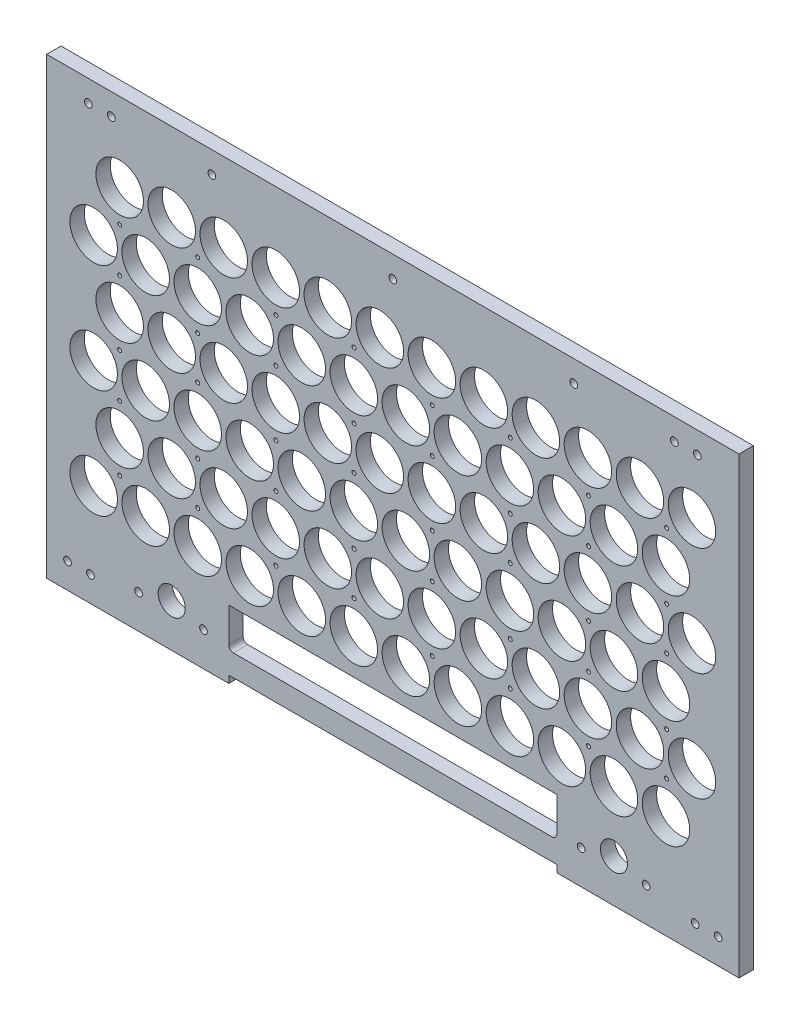
from build123d import *

# Parameters (mm, degrees)
SKETCH1_W                  = 306.05000007
SKETCH1_H                  = 197.4250001
BOSS_EXTRUDE1_DEPTH        = 6.35
SKETCH3_R                  = 10.4988
CUT_EXTRUDE1_DEPTH         = 187.132543615
SKETCH4_R                  = 10.4988
CUT_EXTRUDE2_DEPTH         = 187.132543615
LPATTERN1_COUNT            = 12
LPATTERN1_PITCH            = 23
LPATTERN2_COUNT            = 3
LPATTERN2_PITCH            = 48
LPATTERN2_COPY_1_SKETCH_R  = 10.4988
LPATTERN2_COPY_1_DEPTH     = 187.132543615
LPATTERN2_COPY_2_SKETCH_R  = 10.4988
LPATTERN2_COPY_2_DEPTH     = 187.132543615
LPATTERN2_COPY_3_SKETCH_R  = 10.4988
LPATTERN2_COPY_3_DEPTH     = 187.132543615
LPATTERN2_COPY_4_SKETCH_R  = 10.4988
LPATTERN2_COPY_4_DEPTH     = 187.132543615
LPATTERN2_COPY_5_SKETCH_R  = 10.4988
LPATTERN2_COPY_5_DEPTH     = 187.132543615
LPATTERN2_COPY_6_SKETCH_R  = 10.4988
LPATTERN2_COPY_6_DEPTH     = 187.132543615
LPATTERN2_COPY_7_SKETCH_R  = 10.4988
LPATTERN2_COPY_7_DEPTH     = 187.132543615
LPATTERN2_COPY_8_SKETCH_R  = 10.4988
LPATTERN2_COPY_8_DEPTH     = 187.132543615
LPATTERN2_COPY_9_SKETCH_R  = 10.4988
LPATTERN2_COPY_9_DEPTH     = 187.132543615
LPATTERN2_COPY_10_SKETCH_R = 10.4988
LPATTERN2_COPY_10_DEPTH    = 187.132543615
LPATTERN2_COPY_11_SKETCH_R = 10.4988
LPATTERN2_COPY_11_DEPTH    = 187.132543615
LPATTERN2_COPY_12_SKETCH_R = 10.4988
LPATTERN2_COPY_12_DEPTH    = 187.132543615
LPATTERN2_COPY_13_SKETCH_R = 10.4988
LPATTERN2_COPY_13_DEPTH    = 187.132543615
LPATTERN2_COPY_14_SKETCH_R = 10.4988
LPATTERN2_COPY_14_DEPTH    = 187.132543615
LPATTERN2_COPY_15_SKETCH_R = 10.4988
LPATTERN2_COPY_15_DEPTH    = 187.132543615
LPATTERN2_COPY_16_SKETCH_R = 10.4988
LPATTERN2_COPY_16_DEPTH    = 187.132543615
LPATTERN2_COPY_17_SKETCH_R = 10.4988
LPATTERN2_COPY_17_DEPTH    = 187.132543615
LPATTERN2_COPY_18_SKETCH_R = 10.4988
LPATTERN2_COPY_18_DEPTH    = 187.132543615
LPATTERN2_COPY_19_SKETCH_R = 10.4988
LPATTERN2_COPY_19_DEPTH    = 187.132543615
LPATTERN2_COPY_20_SKETCH_R = 10.4988
LPATTERN2_COPY_20_DEPTH    = 187.132543615
LPATTERN2_COPY_21_SKETCH_R = 10.4988
LPATTERN2_COPY_21_DEPTH    = 187.132543615
LPATTERN2_COPY_22_SKETCH_R = 10.4988
LPATTERN2_COPY_22_DEPTH    = 187.132543615
LPATTERN2_COPY_23_SKETCH_R = 10.4988
LPATTERN2_COPY_23_DEPTH    = 187.132543615
LPATTERN2_COPY_24_SKETCH_R = 10.4988
LPATTERN2_COPY_24_DEPTH    = 187.132543615
LPATTERN2_COPY_25_SKETCH_R = 10.4988
LPATTERN2_COPY_25_DEPTH    = 187.132543615
LPATTERN2_COPY_26_SKETCH_R = 10.4988
LPATTERN2_COPY_26_DEPTH    = 187.132543615
LPATTERN2_COPY_27_SKETCH_R = 10.4988
LPATTERN2_COPY_27_DEPTH    = 187.132543615
LPATTERN2_COPY_28_SKETCH_R = 10.4988
LPATTERN2_COPY_28_DEPTH    = 187.132543615
LPATTERN2_COPY_29_SKETCH_R = 10.4988
LPATTERN2_COPY_29_DEPTH    = 187.132543615
LPATTERN2_COPY_30_SKETCH_R = 10.4988
LPATTERN2_COPY_30_DEPTH    = 187.132543615
LPATTERN2_COPY_31_SKETCH_R = 10.4988
LPATTERN2_COPY_31_DEPTH    = 187.132543615
LPATTERN2_COPY_32_SKETCH_R = 10.4988
LPATTERN2_COPY_32_DEPTH    = 187.132543615
LPATTERN2_COPY_33_SKETCH_R = 10.4988
LPATTERN2_COPY_33_DEPTH    = 187.132543615
LPATTERN2_COPY_34_SKETCH_R = 10.4988
LPATTERN2_COPY_34_DEPTH    = 187.132543615
LPATTERN2_COPY_35_SKETCH_R = 10.4988
LPATTERN2_COPY_35_DEPTH    = 187.132543615
LPATTERN2_COPY_36_SKETCH_R = 10.4988
LPATTERN2_COPY_36_DEPTH    = 187.132543615
LPATTERN2_COPY_37_SKETCH_R = 10.4988
LPATTERN2_COPY_37_DEPTH    = 187.132543615
LPATTERN2_COPY_38_SKETCH_R = 10.4988
LPATTERN2_COPY_38_DEPTH    = 187.132543615
LPATTERN2_COPY_39_SKETCH_R = 10.4988
LPATTERN2_COPY_39_DEPTH    = 187.132543615
LPATTERN2_COPY_40_SKETCH_R = 10.4988
LPATTERN2_COPY_40_DEPTH    = 187.132543615
LPATTERN2_COPY_41_SKETCH_R = 10.4988
LPATTERN2_COPY_41_DEPTH    = 187.132543615
LPATTERN2_COPY_42_SKETCH_R = 10.4988
LPATTERN2_COPY_42_DEPTH    = 187.132543615
LPATTERN2_COPY_43_SKETCH_R = 10.4988
LPATTERN2_COPY_43_DEPTH    = 187.132543615
LPATTERN2_COPY_44_SKETCH_R = 10.4988
LPATTERN2_COPY_44_DEPTH    = 187.132543615
SKETCH13_W                 = 306.05000007
SKETCH13_H                 = 6.35
BOSS_EXTRUDE2_DEPTH        = 3.175
SKETCH14_R                 = 6
CUT_EXTRUDE3_DEPTH         = 187.132543615
M3_CLEARANCE_HOLE1_D       = 3.4
SKETCH18_W                 = 72.5
SKETCH18_H                 = 6.35
CUT_EXTRUDE5_DEPTH         = 30
SKETCH19_W                 = 145
SKETCH19_H                 = 9.525
BOSS_EXTRUDE3_DEPTH        = 6.35
FILLET2_R                  = 2
SKETCH20_R                 = 0.875
CUT_EXTRUDE7_DEPTH         = 187.132543615
LPATTERN3_COUNT            = 4
LPATTERN3_PITCH            = 69.088
LPATTERN3_COUNT_DIR2       = 3
LPATTERN3_PITCH_DIR2       = 48.00092
SKETCH21_R                 = 0.875
CUT_EXTRUDE8_DEPTH         = 187.132543615
LPATTERN4_COUNT            = 4
LPATTERN4_PITCH            = 69.088
LPATTERN4_COUNT_DIR2       = 2
LPATTERN4_PITCH_DIR2       = 48.006


with BuildPart() as part:
    # Sketch1 → Boss-Extrude1 (new body)
    with BuildSketch(Plane.XY):
        with Locations((3.5e-08, -7.06250005)):
            Rectangle(SKETCH1_W, SKETCH1_H)
    extrude(amount=BOSS_EXTRUDE1_DEPTH)

    # Sketch3 → Cut-Extrude1 (cut, through all)
    with BuildSketch(Plane.XY.offset(6.35)):
        with Locations((-132.25, -60)):
            Circle(SKETCH3_R)
    cut_extrude1 = extrude(amount=-CUT_EXTRUDE1_DEPTH, mode=Mode.SUBTRACT)

    # Sketch4 → Cut-Extrude2 (cut, through all)
    with BuildSketch(Plane.XY.offset(6.35)):
        with Locations((-120.75, -36)):
            Circle(SKETCH4_R)
    cut_extrude2 = extrude(amount=-CUT_EXTRUDE2_DEPTH, mode=Mode.SUBTRACT)

    # LPattern1: Cut-Extrude1, Cut-Extrude2 ×12
    with Locations(*[(i * LPATTERN1_PITCH, 0, 0) for i in range(1, LPATTERN1_COUNT)]):
        add(cut_extrude1, mode=Mode.SUBTRACT)
        add(cut_extrude2, mode=Mode.SUBTRACT)

    # LPattern2: Cut-Extrude1, Cut-Extrude2 ×3
    with Locations(*[(0, i * LPATTERN2_PITCH, 0) for i in range(1, LPATTERN2_COUNT)]):
        add(cut_extrude1, mode=Mode.SUBTRACT)
        add(cut_extrude2, mode=Mode.SUBTRACT)

    # LPattern2 copy 1 sketch → LPattern2 copy 1 (cut, through all)
    with BuildSketch(Plane(origin=(23, 48, 6.35), x_dir=(1, 0, 0), z_dir=(0, 0, 1))):
        with Locations((-132.25, -60)):
            Circle(LPATTERN2_COPY_1_SKETCH_R)
    extrude(amount=-LPATTERN2_COPY_1_DEPTH, mode=Mode.SUBTRACT)

    # LPattern2 copy 2 sketch → LPattern2 copy 2 (cut, through all)
    with BuildSketch(Plane(origin=(23, 96, 6.35), x_dir=(1, 0, 0), z_dir=(0, 0, 1))):
        with Locations((-132.25, -60)):
            Circle(LPATTERN2_COPY_2_SKETCH_R)
    extrude(amount=-LPATTERN2_COPY_2_DEPTH, mode=Mode.SUBTRACT)

    # LPattern2 copy 3 sketch → LPattern2 copy 3 (cut, through all)
    with BuildSketch(Plane(origin=(46, 48, 6.35), x_dir=(1, 0, 0), z_dir=(0, 0, 1))):
        with Locations((-132.25, -60)):
            Circle(LPATTERN2_COPY_3_SKETCH_R)
    extrude(amount=-LPATTERN2_COPY_3_DEPTH, mode=Mode.SUBTRACT)

    # LPattern2 copy 4 sketch → LPattern2 copy 4 (cut, through all)
    with BuildSketch(Plane(origin=(46, 96, 6.35), x_dir=(1, 0, 0), z_dir=(0, 0, 1))):
        with Locations((-132.25, -60)):
            Circle(LPATTERN2_COPY_4_SKETCH_R)
    extrude(amount=-LPATTERN2_COPY_4_DEPTH, mode=Mode.SUBTRACT)

    # LPattern2 copy 5 sketch → LPattern2 copy 5 (cut, through all)
    with BuildSketch(Plane(origin=(69, 48, 6.35), x_dir=(1, 0, 0), z_dir=(0, 0, 1))):
        with Locations((-132.25, -60)):
            Circle(LPATTERN2_COPY_5_SKETCH_R)
    extrude(amount=-LPATTERN2_COPY_5_DEPTH, mode=Mode.SUBTRACT)

    # LPattern2 copy 6 sketch → LPattern2 copy 6 (cut, through all)
    with BuildSketch(Plane(origin=(69, 96, 6.35), x_dir=(1, 0, 0), z_dir=(0, 0, 1))):
        with Locations((-132.25, -60)):
            Circle(LPATTERN2_COPY_6_SKETCH_R)
    extrude(amount=-LPATTERN2_COPY_6_DEPTH, mode=Mode.SUBTRACT)

    # LPattern2 copy 7 sketch → LPattern2 copy 7 (cut, through all)
    with BuildSketch(Plane(origin=(92, 48, 6.35), x_dir=(1, 0, 0), z_dir=(0, 0, 1))):
        with Locations((-132.25, -60)):
            Circle(LPATTERN2_COPY_7_SKETCH_R)
    extrude(amount=-LPATTERN2_COPY_7_DEPTH, mode=Mode.SUBTRACT)

    # LPattern2 copy 8 sketch → LPattern2 copy 8 (cut, through all)
    with BuildSketch(Plane(origin=(92, 96, 6.35), x_dir=(1, 0, 0), z_dir=(0, 0, 1))):
        with Locations((-132.25, -60)):
            Circle(LPATTERN2_COPY_8_SKETCH_R)
    extrude(amount=-LPATTERN2_COPY_8_DEPTH, mode=Mode.SUBTRACT)

    # LPattern2 copy 9 sketch → LPattern2 copy 9 (cut, through all)
    with BuildSketch(Plane(origin=(115, 48, 6.35), x_dir=(1, 0, 0), z_dir=(0, 0, 1))):
        with Locations((-132.25, -60)):
            Circle(LPATTERN2_COPY_9_SKETCH_R)
    extrude(amount=-LPATTERN2_COPY_9_DEPTH, mode=Mode.SUBTRACT)

    # LPattern2 copy 10 sketch → LPattern2 copy 10 (cut, through all)
    with BuildSketch(Plane(origin=(115, 96, 6.35), x_dir=(1, 0, 0), z_dir=(0, 0, 1))):
        with Locations((-132.25, -60)):
            Circle(LPATTERN2_COPY_10_SKETCH_R)
    extrude(amount=-LPATTERN2_COPY_10_DEPTH, mode=Mode.SUBTRACT)

    # LPattern2 copy 11 sketch → LPattern2 copy 11 (cut, through all)
    with BuildSketch(Plane(origin=(138, 48, 6.35), x_dir=(1, 0, 0), z_dir=(0, 0, 1))):
        with Locations((-132.25, -60)):
            Circle(LPATTERN2_COPY_11_SKETCH_R)
    extrude(amount=-LPATTERN2_COPY_11_DEPTH, mode=Mode.SUBTRACT)

    # LPattern2 copy 12 sketch → LPattern2 copy 12 (cut, through all)
    with BuildSketch(Plane(origin=(138, 96, 6.35), x_dir=(1, 0, 0), z_dir=(0, 0, 1))):
        with Locations((-132.25, -60)):
            Circle(LPATTERN2_COPY_12_SKETCH_R)
    extrude(amount=-LPATTERN2_COPY_12_DEPTH, mode=Mode.SUBTRACT)

    # LPattern2 copy 13 sketch → LPattern2 copy 13 (cut, through all)
    with BuildSketch(Plane(origin=(161, 48, 6.35), x_dir=(1, 0, 0), z_dir=(0, 0, 1))):
        with Locations((-132.25, -60)):
            Circle(LPATTERN2_COPY_13_SKETCH_R)
    extrude(amount=-LPATTERN2_COPY_13_DEPTH, mode=Mode.SUBTRACT)

    # LPattern2 copy 14 sketch → LPattern2 copy 14 (cut, through all)
    with BuildSketch(Plane(origin=(161, 96, 6.35), x_dir=(1, 0, 0), z_dir=(0, 0, 1))):
        with Locations((-132.25, -60)):
            Circle(LPATTERN2_COPY_14_SKETCH_R)
    extrude(amount=-LPATTERN2_COPY_14_DEPTH, mode=Mode.SUBTRACT)

    # LPattern2 copy 15 sketch → LPattern2 copy 15 (cut, through all)
    with BuildSketch(Plane(origin=(184, 48, 6.35), x_dir=(1, 0, 0), z_dir=(0, 0, 1))):
        with Locations((-132.25, -60)):
            Circle(LPATTERN2_COPY_15_SKETCH_R)
    extrude(amount=-LPATTERN2_COPY_15_DEPTH, mode=Mode.SUBTRACT)

    # LPattern2 copy 16 sketch → LPattern2 copy 16 (cut, through all)
    with BuildSketch(Plane(origin=(184, 96, 6.35), x_dir=(1, 0, 0), z_dir=(0, 0, 1))):
        with Locations((-132.25, -60)):
            Circle(LPATTERN2_COPY_16_SKETCH_R)
    extrude(amount=-LPATTERN2_COPY_16_DEPTH, mode=Mode.SUBTRACT)

    # LPattern2 copy 17 sketch → LPattern2 copy 17 (cut, through all)
    with BuildSketch(Plane(origin=(207, 48, 6.35), x_dir=(1, 0, 0), z_dir=(0, 0, 1))):
        with Locations((-132.25, -60)):
            Circle(LPATTERN2_COPY_17_SKETCH_R)
    extrude(amount=-LPATTERN2_COPY_17_DEPTH, mode=Mode.SUBTRACT)

    # LPattern2 copy 18 sketch → LPattern2 copy 18 (cut, through all)
    with BuildSketch(Plane(origin=(207, 96, 6.35), x_dir=(1, 0, 0), z_dir=(0, 0, 1))):
        with Locations((-132.25, -60)):
            Circle(LPATTERN2_COPY_18_SKETCH_R)
    extrude(amount=-LPATTERN2_COPY_18_DEPTH, mode=Mode.SUBTRACT)

    # LPattern2 copy 19 sketch → LPattern2 copy 19 (cut, through all)
    with BuildSketch(Plane(origin=(230, 48, 6.35), x_dir=(1, 0, 0), z_dir=(0, 0, 1))):
        with Locations((-132.25, -60)):
            Circle(LPATTERN2_COPY_19_SKETCH_R)
    extrude(amount=-LPATTERN2_COPY_19_DEPTH, mode=Mode.SUBTRACT)

    # LPattern2 copy 20 sketch → LPattern2 copy 20 (cut, through all)
    with BuildSketch(Plane(origin=(230, 96, 6.35), x_dir=(1, 0, 0), z_dir=(0, 0, 1))):
        with Locations((-132.25, -60)):
            Circle(LPATTERN2_COPY_20_SKETCH_R)
    extrude(amount=-LPATTERN2_COPY_20_DEPTH, mode=Mode.SUBTRACT)

    # LPattern2 copy 21 sketch → LPattern2 copy 21 (cut, through all)
    with BuildSketch(Plane(origin=(253, 48, 6.35), x_dir=(1, 0, 0), z_dir=(0, 0, 1))):
        with Locations((-132.25, -60)):
            Circle(LPATTERN2_COPY_21_SKETCH_R)
    extrude(amount=-LPATTERN2_COPY_21_DEPTH, mode=Mode.SUBTRACT)

    # LPattern2 copy 22 sketch → LPattern2 copy 22 (cut, through all)
    with BuildSketch(Plane(origin=(253, 96, 6.35), x_dir=(1, 0, 0), z_dir=(0, 0, 1))):
        with Locations((-132.25, -60)):
            Circle(LPATTERN2_COPY_22_SKETCH_R)
    extrude(amount=-LPATTERN2_COPY_22_DEPTH, mode=Mode.SUBTRACT)

    # LPattern2 copy 23 sketch → LPattern2 copy 23 (cut, through all)
    with BuildSketch(Plane(origin=(23, 48, 6.35), x_dir=(1, 0, 0), z_dir=(0, 0, 1))):
        with Locations((-120.75, -36)):
            Circle(LPATTERN2_COPY_23_SKETCH_R)
    extrude(amount=-LPATTERN2_COPY_23_DEPTH, mode=Mode.SUBTRACT)

    # LPattern2 copy 24 sketch → LPattern2 copy 24 (cut, through all)
    with BuildSketch(Plane(origin=(23, 96, 6.35), x_dir=(1, 0, 0), z_dir=(0, 0, 1))):
        with Locations((-120.75, -36)):
            Circle(LPATTERN2_COPY_24_SKETCH_R)
    extrude(amount=-LPATTERN2_COPY_24_DEPTH, mode=Mode.SUBTRACT)

    # LPattern2 copy 25 sketch → LPattern2 copy 25 (cut, through all)
    with BuildSketch(Plane(origin=(46, 48, 6.35), x_dir=(1, 0, 0), z_dir=(0, 0, 1))):
        with Locations((-120.75, -36)):
            Circle(LPATTERN2_COPY_25_SKETCH_R)
    extrude(amount=-LPATTERN2_COPY_25_DEPTH, mode=Mode.SUBTRACT)

    # LPattern2 copy 26 sketch → LPattern2 copy 26 (cut, through all)
    with BuildSketch(Plane(origin=(46, 96, 6.35), x_dir=(1, 0, 0), z_dir=(0, 0, 1))):
        with Locations((-120.75, -36)):
            Circle(LPATTERN2_COPY_26_SKETCH_R)
    extrude(amount=-LPATTERN2_COPY_26_DEPTH, mode=Mode.SUBTRACT)

    # LPattern2 copy 27 sketch → LPattern2 copy 27 (cut, through all)
    with BuildSketch(Plane(origin=(69, 48, 6.35), x_dir=(1, 0, 0), z_dir=(0, 0, 1))):
        with Locations((-120.75, -36)):
            Circle(LPATTERN2_COPY_27_SKETCH_R)
    extrude(amount=-LPATTERN2_COPY_27_DEPTH, mode=Mode.SUBTRACT)

    # LPattern2 copy 28 sketch → LPattern2 copy 28 (cut, through all)
    with BuildSketch(Plane(origin=(69, 96, 6.35), x_dir=(1, 0, 0), z_dir=(0, 0, 1))):
        with Locations((-120.75, -36)):
            Circle(LPATTERN2_COPY_28_SKETCH_R)
    extrude(amount=-LPATTERN2_COPY_28_DEPTH, mode=Mode.SUBTRACT)

    # LPattern2 copy 29 sketch → LPattern2 copy 29 (cut, through all)
    with BuildSketch(Plane(origin=(92, 48, 6.35), x_dir=(1, 0, 0), z_dir=(0, 0, 1))):
        with Locations((-120.75, -36)):
            Circle(LPATTERN2_COPY_29_SKETCH_R)
    extrude(amount=-LPATTERN2_COPY_29_DEPTH, mode=Mode.SUBTRACT)

    # LPattern2 copy 30 sketch → LPattern2 copy 30 (cut, through all)
    with BuildSketch(Plane(origin=(92, 96, 6.35), x_dir=(1, 0, 0), z_dir=(0, 0, 1))):
        with Locations((-120.75, -36)):
            Circle(LPATTERN2_COPY_30_SKETCH_R)
    extrude(amount=-LPATTERN2_COPY_30_DEPTH, mode=Mode.SUBTRACT)

    # LPattern2 copy 31 sketch → LPattern2 copy 31 (cut, through all)
    with BuildSketch(Plane(origin=(115, 48, 6.35), x_dir=(1, 0, 0), z_dir=(0, 0, 1))):
        with Locations((-120.75, -36)):
            Circle(LPATTERN2_COPY_31_SKETCH_R)
    extrude(amount=-LPATTERN2_COPY_31_DEPTH, mode=Mode.SUBTRACT)

    # LPattern2 copy 32 sketch → LPattern2 copy 32 (cut, through all)
    with BuildSketch(Plane(origin=(115, 96, 6.35), x_dir=(1, 0, 0), z_dir=(0, 0, 1))):
        with Locations((-120.75, -36)):
            Circle(LPATTERN2_COPY_32_SKETCH_R)
    extrude(amount=-LPATTERN2_COPY_32_DEPTH, mode=Mode.SUBTRACT)

    # LPattern2 copy 33 sketch → LPattern2 copy 33 (cut, through all)
    with BuildSketch(Plane(origin=(138, 48, 6.35), x_dir=(1, 0, 0), z_dir=(0, 0, 1))):
        with Locations((-120.75, -36)):
            Circle(LPATTERN2_COPY_33_SKETCH_R)
    extrude(amount=-LPATTERN2_COPY_33_DEPTH, mode=Mode.SUBTRACT)

    # LPattern2 copy 34 sketch → LPattern2 copy 34 (cut, through all)
    with BuildSketch(Plane(origin=(138, 96, 6.35), x_dir=(1, 0, 0), z_dir=(0, 0, 1))):
        with Locations((-120.75, -36)):
            Circle(LPATTERN2_COPY_34_SKETCH_R)
    extrude(amount=-LPATTERN2_COPY_34_DEPTH, mode=Mode.SUBTRACT)

    # LPattern2 copy 35 sketch → LPattern2 copy 35 (cut, through all)
    with BuildSketch(Plane(origin=(161, 48, 6.35), x_dir=(1, 0, 0), z_dir=(0, 0, 1))):
        with Locations((-120.75, -36)):
            Circle(LPATTERN2_COPY_35_SKETCH_R)
    extrude(amount=-LPATTERN2_COPY_35_DEPTH, mode=Mode.SUBTRACT)

    # LPattern2 copy 36 sketch → LPattern2 copy 36 (cut, through all)
    with BuildSketch(Plane(origin=(161, 96, 6.35), x_dir=(1, 0, 0), z_dir=(0, 0, 1))):
        with Locations((-120.75, -36)):
            Circle(LPATTERN2_COPY_36_SKETCH_R)
    extrude(amount=-LPATTERN2_COPY_36_DEPTH, mode=Mode.SUBTRACT)

    # LPattern2 copy 37 sketch → LPattern2 copy 37 (cut, through all)
    with BuildSketch(Plane(origin=(184, 48, 6.35), x_dir=(1, 0, 0), z_dir=(0, 0, 1))):
        with Locations((-120.75, -36)):
            Circle(LPATTERN2_COPY_37_SKETCH_R)
    extrude(amount=-LPATTERN2_COPY_37_DEPTH, mode=Mode.SUBTRACT)

    # LPattern2 copy 38 sketch → LPattern2 copy 38 (cut, through all)
    with BuildSketch(Plane(origin=(184, 96, 6.35), x_dir=(1, 0, 0), z_dir=(0, 0, 1))):
        with Locations((-120.75, -36)):
            Circle(LPATTERN2_COPY_38_SKETCH_R)
    extrude(amount=-LPATTERN2_COPY_38_DEPTH, mode=Mode.SUBTRACT)

    # LPattern2 copy 39 sketch → LPattern2 copy 39 (cut, through all)
    with BuildSketch(Plane(origin=(207, 48, 6.35), x_dir=(1, 0, 0), z_dir=(0, 0, 1))):
        with Locations((-120.75, -36)):
            Circle(LPATTERN2_COPY_39_SKETCH_R)
    extrude(amount=-LPATTERN2_COPY_39_DEPTH, mode=Mode.SUBTRACT)

    # LPattern2 copy 40 sketch → LPattern2 copy 40 (cut, through all)
    with BuildSketch(Plane(origin=(207, 96, 6.35), x_dir=(1, 0, 0), z_dir=(0, 0, 1))):
        with Locations((-120.75, -36)):
            Circle(LPATTERN2_COPY_40_SKETCH_R)
    extrude(amount=-LPATTERN2_COPY_40_DEPTH, mode=Mode.SUBTRACT)

    # LPattern2 copy 41 sketch → LPattern2 copy 41 (cut, through all)
    with BuildSketch(Plane(origin=(230, 48, 6.35), x_dir=(1, 0, 0), z_dir=(0, 0, 1))):
        with Locations((-120.75, -36)):
            Circle(LPATTERN2_COPY_41_SKETCH_R)
    extrude(amount=-LPATTERN2_COPY_41_DEPTH, mode=Mode.SUBTRACT)

    # LPattern2 copy 42 sketch → LPattern2 copy 42 (cut, through all)
    with BuildSketch(Plane(origin=(230, 96, 6.35), x_dir=(1, 0, 0), z_dir=(0, 0, 1))):
        with Locations((-120.75, -36)):
            Circle(LPATTERN2_COPY_42_SKETCH_R)
    extrude(amount=-LPATTERN2_COPY_42_DEPTH, mode=Mode.SUBTRACT)

    # LPattern2 copy 43 sketch → LPattern2 copy 43 (cut, through all)
    with BuildSketch(Plane(origin=(253, 48, 6.35), x_dir=(1, 0, 0), z_dir=(0, 0, 1))):
        with Locations((-120.75, -36)):
            Circle(LPATTERN2_COPY_43_SKETCH_R)
    extrude(amount=-LPATTERN2_COPY_43_DEPTH, mode=Mode.SUBTRACT)

    # LPattern2 copy 44 sketch → LPattern2 copy 44 (cut, through all)
    with BuildSketch(Plane(origin=(253, 96, 6.35), x_dir=(1, 0, 0), z_dir=(0, 0, 1))):
        with Locations((-120.75, -36)):
            Circle(LPATTERN2_COPY_44_SKETCH_R)
    extrude(amount=-LPATTERN2_COPY_44_DEPTH, mode=Mode.SUBTRACT)

    # Sketch13 → Boss-Extrude2 (add)
    with BuildSketch(Plane(origin=(0, 91.65, 0), x_dir=(1, 0, 0), z_dir=(0, 1, 0))):
        with Locations((3.5e-08, -3.175)):
            Rectangle(SKETCH13_W, SKETCH13_H)
    extrude(amount=BOSS_EXTRUDE2_DEPTH)

    # Sketch14 → Cut-Extrude3 (cut, through all)
    with BuildSketch(Plane(origin=(0, 0, 0), x_dir=(-1, 0, 0), z_dir=(0, 0, -1))):
        with Locations((-97.75, -86.7750001)):
            Circle(SKETCH14_R)
    cut_extrude3 = extrude(amount=-CUT_EXTRUDE3_DEPTH, mode=Mode.SUBTRACT)

    # Mirror1: Cut-Extrude3 across plane
    add(cut_extrude3.mirror(Plane(origin=(0, 0, 0), x_dir=(0, 0, 1), z_dir=(1, 0, 0))), mode=Mode.SUBTRACT)

    # M3 Clearance Hole1 (through all)
    with Locations(Plane(origin=(0, 0, 0), x_dir=(-1, 0, 0), z_dir=(0, 0, -1))):
        with Locations((-111.94, -90.775), (-83.25, -90.775), (83.712, -90.775), (80, 85.3), (0, 85.3), (-80, 85.3), (112.402, -90.775), (-143.817500066, -94.6000001), (-133.657500066, -94.6000001), (-134.610000066, 85.3), (-124.450000066, 85.3), (124.450000066, 85.3), (134.610000066, 85.3), (133.657500066, -94.6000001), (143.817500066, -94.6000001)):
            Hole(M3_CLEARANCE_HOLE1_D / 2)

    # Sketch18 → Cut-Extrude5 (cut)
    with BuildSketch(Plane.XZ.offset(105.7750001)):
        with Locations((36.25, 3.175)):
            Rectangle(SKETCH18_W, SKETCH18_H)
        with Locations((-36.25, 3.175)):
            Rectangle(SKETCH18_W, SKETCH18_H)
    extrude(amount=-CUT_EXTRUDE5_DEPTH, mode=Mode.SUBTRACT)

    # Sketch19 → Boss-Extrude3 (add)
    with BuildSketch(Plane(origin=(0, 0, 0), x_dir=(-1, 0, 0), z_dir=(0, 0, -1))):
        with Locations((0, -97.8375001)):
            Rectangle(SKETCH19_W, SKETCH19_H)
    extrude(amount=-BOSS_EXTRUDE3_DEPTH)

    # Fillet2
    fillet2_edges = [part.edges().sort_by_distance(p)[0] for p in [
        (72.5, -93.0750001, 3.175),
        (-72.5, -93.0750001, 3.175),
    ]]
    fillet(fillet2_edges, radius=FILLET2_R)

    # Sketch20 → Cut-Extrude7 (cut, through all)
    with BuildSketch(Plane(origin=(0, 0, 0), x_dir=(-1, 0, 0), z_dir=(0, 0, -1))):
        with Locations((120.75, -50.28293229)):
            Circle(SKETCH20_R)
        with Locations((86.25, -45.467986122)):
            Circle(SKETCH20_R)
    cut_extrude7 = extrude(amount=-CUT_EXTRUDE7_DEPTH, mode=Mode.SUBTRACT)

    # LPattern3: Cut-Extrude7 4 × 3
    with Locations(*[(i * LPATTERN3_PITCH, j * LPATTERN3_PITCH_DIR2, 0) for i in range(LPATTERN3_COUNT) for j in range(LPATTERN3_COUNT_DIR2) if (i, j) != (0, 0)]):
        add(cut_extrude7, mode=Mode.SUBTRACT)

    # Sketch21 → Cut-Extrude8 (cut, through all)
    with BuildSketch(Plane(origin=(0, 0, 0), x_dir=(-1, 0, 0), z_dir=(0, 0, -1))):
        with Locations((120.75, -21.71706771)):
            Circle(SKETCH21_R)
        with Locations((86.25, -26.532013878)):
            Circle(SKETCH21_R)
    cut_extrude8 = extrude(amount=-CUT_EXTRUDE8_DEPTH, mode=Mode.SUBTRACT)

    # LPattern4: Cut-Extrude8 4 × 2
    with Locations(*[(i * LPATTERN4_PITCH, j * LPATTERN4_PITCH_DIR2, 0) for i in range(LPATTERN4_COUNT) for j in range(LPATTERN4_COUNT_DIR2) if (i, j) != (0, 0)]):
        add(cut_extrude8, mode=Mode.SUBTRACT)


solid = part.part
